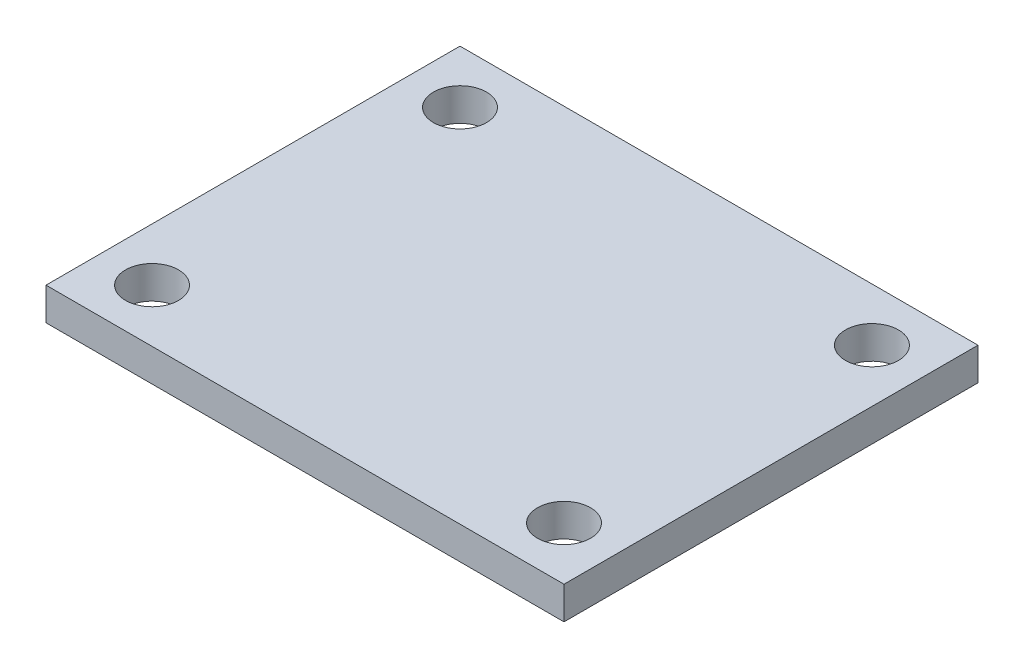
from build123d import *

# Parameters (mm, degrees)
SKETCH_1_W          = 25.4
SKETCH_1_H          = 20.3
EXTRUDE_1_DEPTH     = 1.6
SKETCH_3_R          = 1.3
CUT_EXTRUDE_1_DEPTH = 1.6


with BuildPart() as part:
    # Эскиз1 → Бобышка-Вытянуть1 (new body)
    with BuildSketch(Plane(origin=(0, 0, 0), x_dir=(1, 0, 0), z_dir=(0, 1, 0))):
        Rectangle(SKETCH_1_W, SKETCH_1_H)
    extrude(amount=EXTRUDE_1_DEPTH)

    # Эскиз3 → Вырез-Вытянуть1 (cut)
    with BuildSketch(Plane(origin=(0, 1.6, 0), x_dir=(1, 0, 0), z_dir=(0, 1, 0))):
        with Locations(Location((-10.1, 7.55, 0), (0, 0, 270))):
            Circle(SKETCH_3_R)
        with Locations(Location((10.1, 7.55, 0), (0, 0, 90))):
            Circle(SKETCH_3_R)
        with Locations(Location((10.1, -7.55, 0), (0, 0, 270))):
            Circle(SKETCH_3_R)
        with Locations(Location((-10.1, -7.55, 0), (0, 0, 90))):
            Circle(SKETCH_3_R)
    extrude(amount=-CUT_EXTRUDE_1_DEPTH, mode=Mode.SUBTRACT)


solid = part.part
